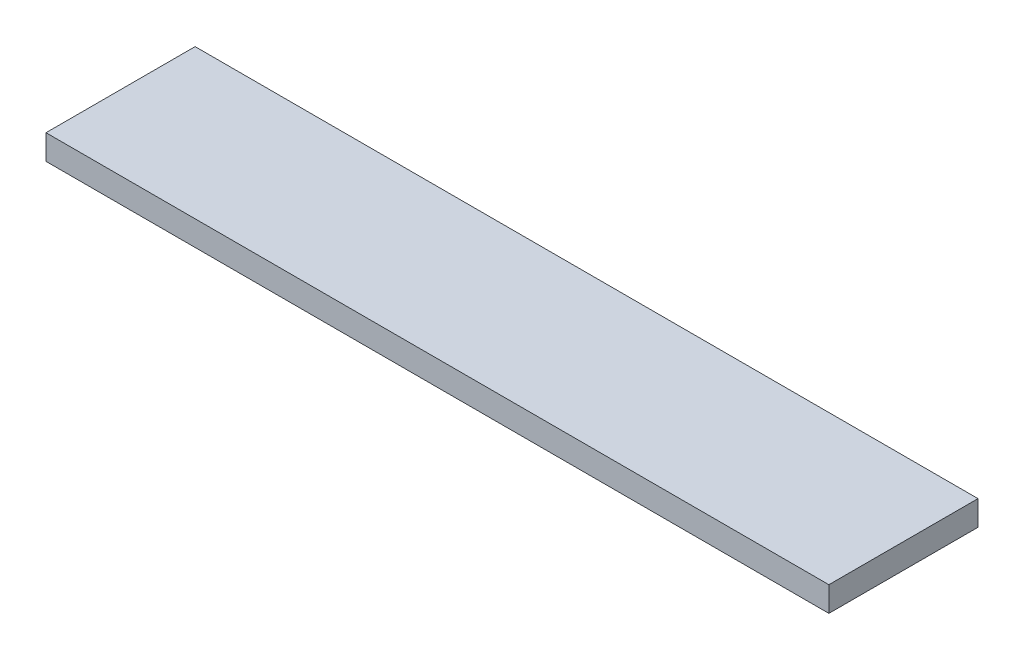
from build123d import *

# Parameters (mm, degrees)
SKETCH1_W           = 63
SKETCH1_H           = 12
BOSS_EXTRUDE1_DEPTH = 2


with BuildPart() as part:
    # Sketch1 → Boss-Extrude1 (new body)
    with BuildSketch(Plane(origin=(0, 0, 0), x_dir=(1, 0, 0), z_dir=(0, 1, 0))):
        Rectangle(SKETCH1_W, SKETCH1_H)
    extrude(amount=BOSS_EXTRUDE1_DEPTH)


solid = part.part
